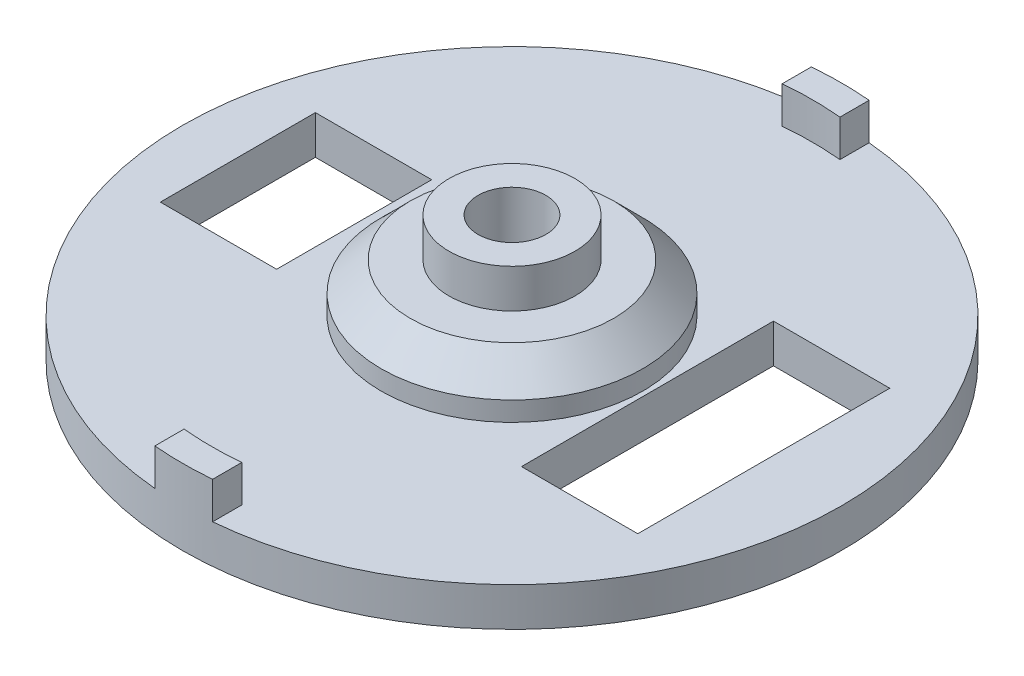
from build123d import *

# Parameters (mm, degrees)
SKETCH1_R           = 17
SKETCH1_R_2         = 1.75
SKETCH1_W           = 6
SKETCH1_H           = 13
SKETCH1_H_2         = 8
BOSS_EXTRUDE1_DEPTH = 2
SKETCH1_3_R         = 6.75
SKETCH1_3_R_2       = 1.75
BOSS_EXTRUDE2_DEPTH = 4.5
SKETCH1_4_R         = 3.25
SKETCH1_4_R_2       = 1.75
BOSS_EXTRUDE3_DEPTH = 6.5
SKETCH1_5_R         = 1.75
CUT_EXTRUDE1_DEPTH  = 2.5
BOSS_EXTRUDE4_DEPTH = 1.9
CUT_EXTRUDE2_DEPTH  = 3
CHAMFER1_SIZE       = 1.5


with BuildPart() as part:
    # Sketch1 → Boss-Extrude1 (new body)
    with BuildSketch(Plane(origin=(0, 0, 0), x_dir=(1, 0, 0), z_dir=(0, 1, 0))):
        Circle(SKETCH1_R)
        Circle(SKETCH1_R_2, mode=Mode.SUBTRACT)
        with Locations((9.99, 0)):
            Rectangle(SKETCH1_W, SKETCH1_H, mode=Mode.SUBTRACT)
        with Locations((-11.142, 0)):
            Rectangle(SKETCH1_W, SKETCH1_H_2, mode=Mode.SUBTRACT)
    extrude(amount=BOSS_EXTRUDE1_DEPTH)

    # Sketch1<3> → Boss-Extrude2 (add)
    with BuildSketch(Plane(origin=(0, 0, 0), x_dir=(1, 0, 0), z_dir=(0, 1, 0))):
        Circle(SKETCH1_3_R)
        Circle(SKETCH1_3_R_2, mode=Mode.SUBTRACT)
    extrude(amount=BOSS_EXTRUDE2_DEPTH)

    # Sketch1<4> → Boss-Extrude3 (add)
    with BuildSketch(Plane(origin=(0, 0, 0), x_dir=(1, 0, 0), z_dir=(0, 1, 0))):
        Circle(SKETCH1_4_R)
        Circle(SKETCH1_4_R_2, mode=Mode.SUBTRACT)
    extrude(amount=BOSS_EXTRUDE3_DEPTH)

    # Sketch1<5> → Cut-Extrude1 (cut)
    with BuildSketch(Plane(origin=(0, 0, 0), x_dir=(1, 0, 0), z_dir=(0, 1, 0))):
        Polygon((2.323834833, -4.025), (4.647669667, 0), (2.323834833, 4.025), (-2.323834833, 4.025), (-4.647669667, 0), (-2.323834833, -4.025), align=None)
        Circle(SKETCH1_5_R, mode=Mode.SUBTRACT)
    extrude(amount=CUT_EXTRUDE1_DEPTH, mode=Mode.SUBTRACT)

    # Sketch2 → Boss-Extrude4 (add)
    with BuildSketch(Plane(origin=(0, 2, 0), x_dir=(1, 0, 0), z_dir=(0, 1, 0))):
        with BuildLine():
            ThreePointArc((1.49, 16.934577054), (0, 17), (-1.49, 16.934577054))
            Line((-1.49, 16.934577054), (-1.49, 15.428217655))
            ThreePointArc((-1.49, 15.428217655), (0, 15.5), (1.49, 15.428217655))
            Line((1.49, 15.428217655), (1.49, 16.934577054))
        make_face()
        with BuildLine():
            Line((-1.49, -15.428217655), (-1.49, -16.934577054))
            ThreePointArc((-1.49, -16.934577054), (0, -17), (1.49, -16.934577054))
            Line((1.49, -16.934577054), (1.49, -15.428217655))
            ThreePointArc((1.49, -15.428217655), (0, -15.5), (-1.49, -15.428217655))
        make_face()
    extrude(amount=BOSS_EXTRUDE4_DEPTH)

    # Sketch4 → Cut-Extrude2 (cut)
    with BuildSketch(Plane.XZ):
        with BuildLine():
            Line((-2.323834833, 4.025), (2.323666704, 4.025))
            Line((2.323666704, 4.025), (2.323666704, 4.98503491))
            ThreePointArc((2.323666704, 4.98503491), (-9.275e-05, 5.499999999), (-2.323834833, 4.984956536))
            Line((-2.323834833, 4.984956536), (-2.323834833, 4.025))
        make_face()
        with BuildLine():
            Line((2.323666704, -4.025), (2.323666704, -4.98503491))
            ThreePointArc((2.323666704, -4.98503491), (0, -5.5), (-2.323666704, -4.98503491))
            Line((-2.323666704, -4.98503491), (-2.323834833, -4.025))
            Line((-2.323834833, -4.025), (2.323666704, -4.025))
        make_face()
    extrude(amount=-CUT_EXTRUDE2_DEPTH, mode=Mode.SUBTRACT)

    # Chamfer1
    chamfer1_edges = [part.edges().sort_by_distance(p)[0] for p in [
        (-6.75, 4.5, 0),
    ]]
    chamfer(chamfer1_edges, length=CHAMFER1_SIZE)


solid = part.part
